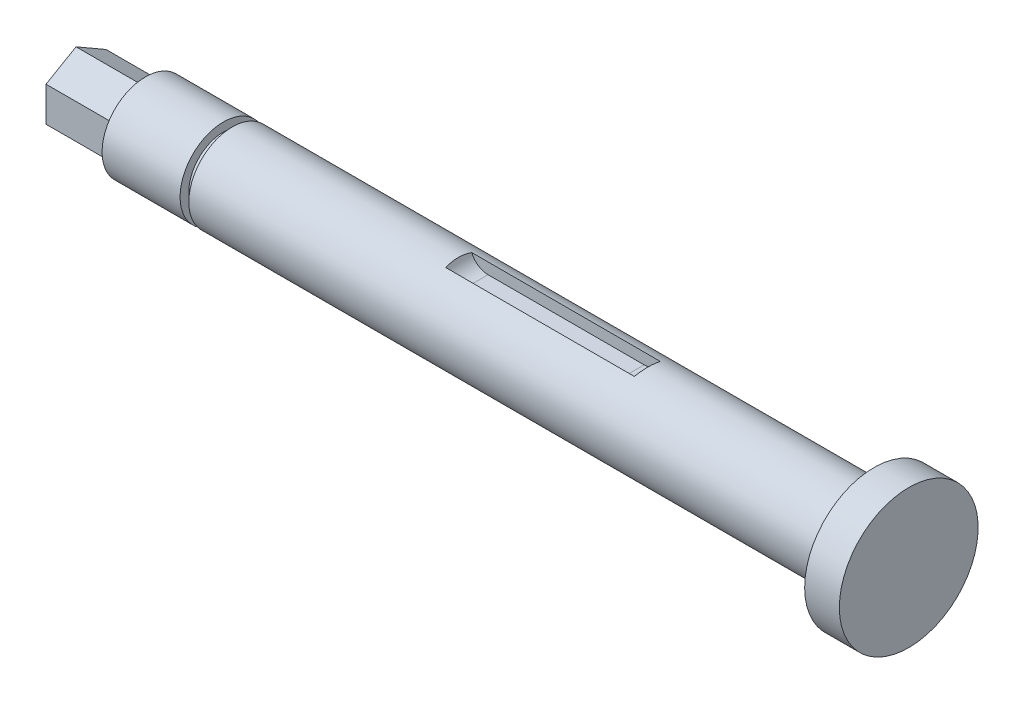
from build123d import *

# Parameters (mm, degrees)
CUT_EXTRUDE1_DEPTH = 2.38125
SKETCH6_OUTSIDE_W  = 58.716
SKETCH6_OUTSIDE_H  = 58.716
CUT_EXTRUDE2_DEPTH = 12.7


with BuildPart() as part:
    # Sketch2 → Revolve1 (revolve)
    with BuildSketch(Plane.XY, mode=Mode.PRIVATE) as revolve1_sk:
        Polygon((0, 0), (0, 6.35), (12.7, 6.35), (12.7, 7.9375), (26.9748, 7.9375), (26.9748, 6.3373), (28.575, 6.3373), (28.575, 7.9375), (146.05, 7.9375), (146.05, 12.7), (152.4, 12.7), (152.4, 0), align=None)
    revolve(revolve1_sk.sketch.rotate(Axis((-160.725070543, 0, 0), (1, 0, 0)), 90), axis=Axis((-160.725070543, 0, 0), (1, 0, 0)))

    # Sketch3 → Cut-Extrude1 (cut, symmetric)
    with BuildSketch(Plane.XY):
        with BuildLine():
            Line((69.85, 14.2875), (104.775, 14.2875))
            Line((104.775, 14.2875), (104.775, 8.7249))
            ThreePointArc((104.775, 8.7249), (103.84506403, 6.47983597), (101.6, 5.5499))
            Line((101.6, 5.5499), (73.025, 5.5499))
            ThreePointArc((73.025, 5.5499), (70.77993597, 6.47983597), (69.85, 8.7249))
            Line((69.85, 8.7249), (69.85, 14.2875))
        make_face()
    extrude(amount=CUT_EXTRUDE1_DEPTH, both=True, mode=Mode.SUBTRACT)

    # Sketch6 outside → Cut-Extrude2 (cut)
    with BuildSketch(Plane.ZY):
        Rectangle(SKETCH6_OUTSIDE_W, SKETCH6_OUTSIDE_H)
        Polygon((0, 6.35), (-5.499261314, 3.175), (-5.499261314, -3.175), (0, -6.35), (5.499261314, -3.175), (5.499261314, 3.175), align=None, mode=Mode.SUBTRACT)
    extrude(amount=-CUT_EXTRUDE2_DEPTH, mode=Mode.SUBTRACT)


solid = part.part
